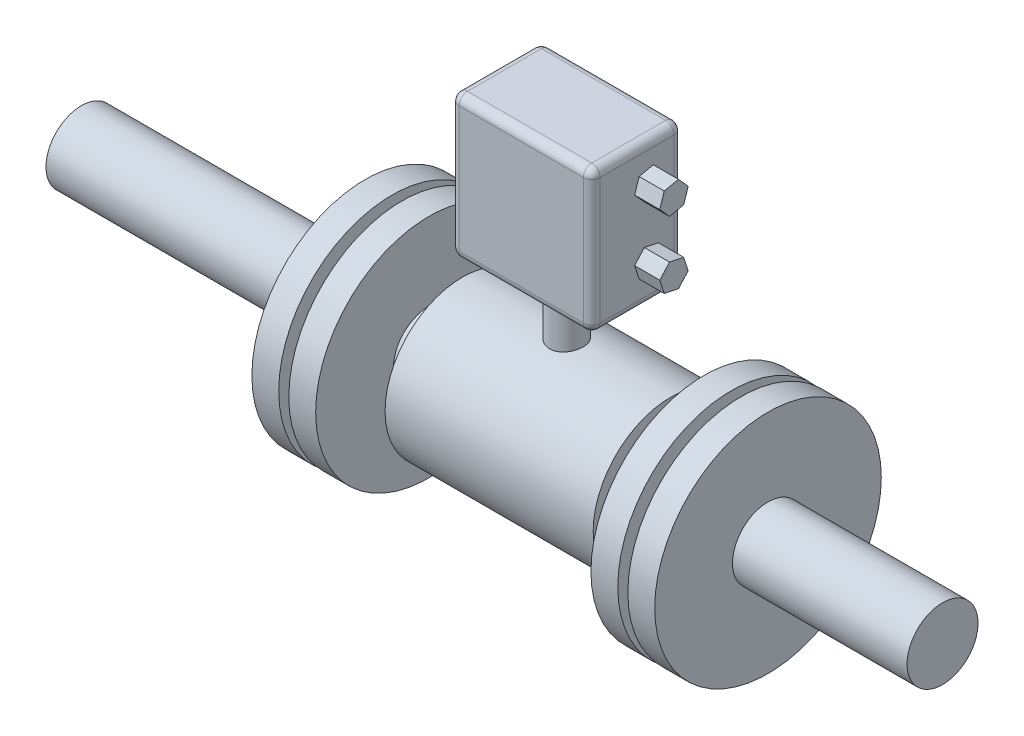
from build123d import *

# Parameters (mm, degrees)
SKETCH_4_R      = 10
EXTRUDE_3_DEPTH = 165.5
SKETCH_5_W      = 84
SKETCH_5_H      = 54
EXTRUDE_4_DEPTH = 85
FILLET_1_R      = 5
EXTRUDE_5_DEPTH = 15


with BuildPart() as part:
    # Эскиз3 → Повернуть2 (revolve)
    with BuildSketch(Plane(origin=(0, 0, 0), x_dir=(1, 0, 0), z_dir=(0, 1, 0))):
        Polygon((82, -67.5), (98, -67.5), (98, -33), (104, -33), (104, -67.5), (120, -67.5), (120, -21.15), (224, -21.15), (224, 0), (-289, 0), (-289, -21.15), (-120, -21.15), (-120, -67.5), (-104, -67.5), (-104, -33), (-98, -33), (-98, -67.5), (-82, -67.5), (-82, -21.15), (-62, -21.15), (-62, -46.15), (62, -46.15), (62, -21.15), (82, -21.15), align=None)
    revolve(axis=Axis((-117.293644386, 0, 0), (1, 0, 0)))

    # Эскиз4 → Вытянуть3 (add)
    with BuildSketch(Plane(origin=(0, 0, 0), x_dir=(1, 0, 0), z_dir=(0, 1, 0))):
        Circle(SKETCH_4_R)
    extrude(amount=EXTRUDE_3_DEPTH)

    # Эскиз5 → Вытянуть4 (add)
    with BuildSketch(Plane(origin=(0, 165.5, 0), x_dir=(-1, 0, 0), z_dir=(0, 1, 0))):
        Rectangle(SKETCH_5_W, SKETCH_5_H)
    extrude(amount=-EXTRUDE_4_DEPTH)

    # Скругление1
    fillet_1_edges = [part.edges().sort_by_distance(p)[0] for p in [
        (42, 165.5, 0),
        (0, 165.5, 27),
        (0, 165.5, -27),
        (-42, 165.5, 0),
        (-42, 123, -27),
        (-42, 80.5, 0),
        (0, 80.5, -27),
        (42, 80.5, 0),
        (0, 80.5, 27),
        (-42, 123, 27),
        (42, 123, -27),
        (42, 123, 27),
    ]]
    fillet(fillet_1_edges, radius=FILLET_1_R)

    # Эскиз6 → Вытянуть5 (add)
    with BuildSketch(Plane(origin=(42, 0, 0), x_dir=(0, 0, -1), z_dir=(1, 0, 0))):
        Polygon((4.321367474, 134.764410902), (12.792913111, 136.562441636), (15.471545637, 144.798030734), (9.678632526, 151.235589098), (1.207086889, 149.437558364), (-1.471545637, 141.201969266), align=None)
        Polygon((-1.471545637, 104.798030734), (4.321367474, 111.235589098), (12.792913111, 109.437558364), (15.471545637, 101.201969266), (9.678632526, 94.764410902), (1.207086889, 96.562441636), align=None)
    extrude(amount=EXTRUDE_5_DEPTH)


solid = part.part
